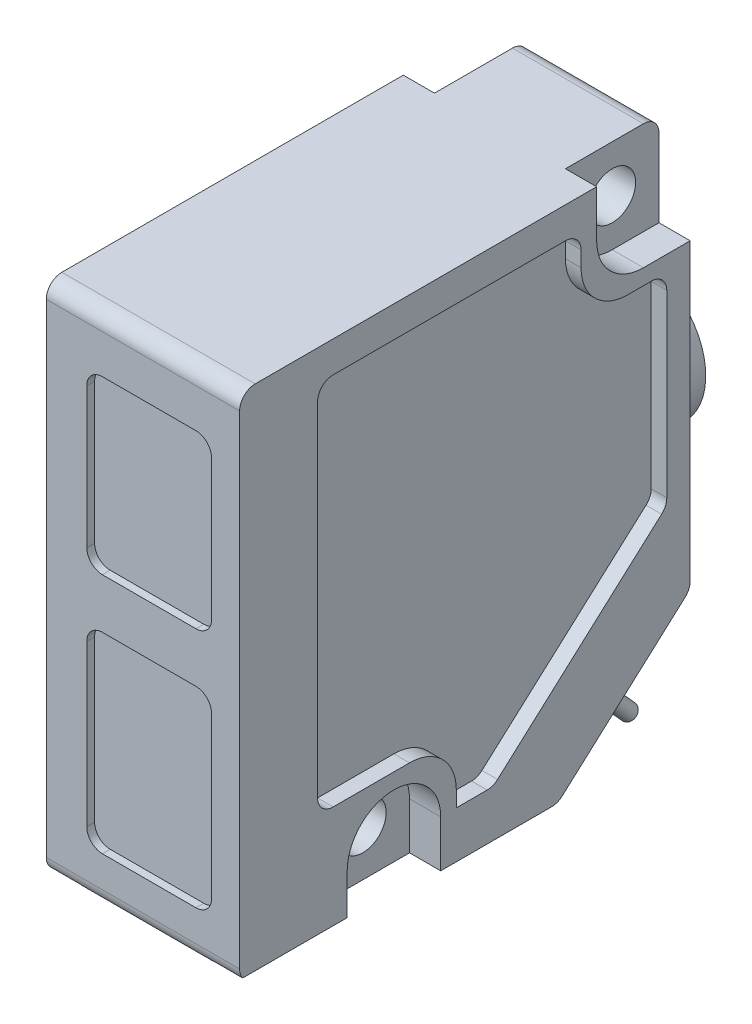
from build123d import *

# Parameters (mm, degrees)
BOSS_EXTRUDE1_DEPTH = 12.4
SKETCH2_R           = 1.5
CUT_EXTRUDE1_DEPTH  = 46.584756224
CUT_EXTRUDE2_DEPTH  = 2
CUT_EXTRUDE3_START  = -2
CUT_EXTRUDE3_DEPTH  = 2
CUT_EXTRUDE4_DEPTH  = 1
CUT_EXTRUDE5_START  = -1
CUT_EXTRUDE5_DEPTH  = 1
CUT_EXTRUDE6_DEPTH  = 0.5
SKETCH9_R           = 4.5
BOSS_EXTRUDE2_DEPTH = 0.5
SKETCH10_R          = 4.25
BOSS_EXTRUDE3_DEPTH = 0.5
SKETCH11_R          = 4.5
BOSS_EXTRUDE4_DEPTH = 1
SKETCH12_R          = 3
BOSS_EXTRUDE5_DEPTH = 1
SKETCH13_R          = 2
BOSS_EXTRUDE6_DEPTH = 3
BOSS_EXTRUDE7_DEPTH = 5


with BuildPart() as part:
    # Sketch1 → Boss-Extrude1 (new body)
    with BuildSketch(Plane(origin=(0, 0, 0), x_dir=(0, 0, -1), z_dir=(1, 0, 0))):
        with BuildLine():
            Line((1, 0), (27.9, 0))
            ThreePointArc((27.9, 0), (28.607106781, -0.292893219), (28.9, -1))
            Line((28.9, -1), (28.9, -24.904637595))
            ThreePointArc((28.9, -24.904637595), (28.813500063, -25.31147618), (28.568964732, -25.647931742))
            Line((28.568964732, -25.647931742), (20.685228726, -32.743294146))
            ThreePointArc((20.685228726, -32.743294146), (20.374527762, -32.933620412), (20.016263995, -33))
            Line((20.016263995, -33), (1, -33))
            ThreePointArc((1, -33), (0.292893219, -32.707106781), (0, -32))
            Line((0, -32), (0, -1))
            ThreePointArc((0, -1), (0.292893219, -0.292893219), (1, 0))
        make_face()
    extrude(amount=BOSS_EXTRUDE1_DEPTH)

    # Sketch2 → Cut-Extrude1 (cut, through all)
    with BuildSketch(Plane(origin=(12.4, 0, 0), x_dir=(0, 0, -1), z_dir=(1, 0, 0))):
        with Locations((25.9, -3)):
            Circle(SKETCH2_R)
        with Locations((9.9, -30)):
            Circle(SKETCH2_R)
    extrude(amount=-CUT_EXTRUDE1_DEPTH, mode=Mode.SUBTRACT)

    # Sketch3 → Cut-Extrude2 (cut)
    with BuildSketch(Plane(origin=(12.4, 0, 0), x_dir=(0, 0, -1), z_dir=(1, 0, 0))):
        with BuildLine():
            Line((6.9, -30), (6.9, -32.602246067))
            Line((6.9, -32.602246067), (0, -32.602246067))
            Line((0, -32.602246067), (0, -33))
            Line((0, -33), (6.9, -33))
            Line((6.9, -33), (12.9, -33))
            Line((12.9, -33), (12.9, -30))
            ThreePointArc((12.9, -30), (9.9, -27), (6.9, -30))
        make_face()
        with BuildLine():
            Line((22.9, 0), (28.9, 0))
            Line((28.9, 0), (28.9, -6))
            Line((28.9, -6), (25.9, -6))
            ThreePointArc((25.9, -6), (23.778679656, -5.121320344), (22.9, -3))
            Line((22.9, -3), (22.9, 0))
        make_face()
    extrude(amount=-CUT_EXTRUDE2_DEPTH, mode=Mode.SUBTRACT)

    # Sketch4 → Cut-Extrude3 (cut)
    with BuildSketch(Plane.ZY.offset(CUT_EXTRUDE3_START)):
        with BuildLine():
            Line((-12.9, -30), (-12.9, -33))
            Line((-12.9, -33), (-6.9, -33))
            Line((-6.9, -33), (0, -33))
            Line((0, -33), (0, -32.6))
            Line((0, -32.6), (-6.9, -32.6))
            Line((-6.9, -32.6), (-6.9, -30))
            ThreePointArc((-6.9, -30), (-9.9, -27), (-12.9, -30))
        make_face()
        with BuildLine():
            Line((-28.9, 0), (-22.9, 0))
            Line((-22.9, 0), (-22.9, -3))
            ThreePointArc((-22.9, -3), (-23.778679656, -5.121320344), (-25.9, -6))
            Line((-25.9, -6), (-28.9, -6))
            Line((-28.9, -6), (-28.9, 0))
        make_face()
    extrude(amount=CUT_EXTRUDE3_DEPTH, mode=Mode.SUBTRACT)

    # Sketch5 → Cut-Extrude4 (cut)
    with BuildSketch(Plane(origin=(12.4, 0, 0), x_dir=(0, 0, -1), z_dir=(1, 0, 0))):
        with BuildLine():
            Line((5, -3), (5, -25))
            ThreePointArc((5, -25), (5.292893219, -25.707106781), (6, -26))
            Line((6, -26), (10.9, -26))
            ThreePointArc((10.9, -26), (13.021320344, -26.878679656), (13.9, -29))
            Line((13.9, -29), (13.9, -30))
            Line((13.9, -30), (15.875361746, -30))
            ThreePointArc((15.875361746, -30), (16.233625514, -29.933620412), (16.544326478, -29.743294146))
            Line((16.544326478, -29.743294146), (27.068964732, -20.271119718))
            ThreePointArc((27.068964732, -20.271119718), (27.313500063, -19.934664157), (27.4, -19.527825572))
            Line((27.4, -19.527825572), (27.4, -8))
            ThreePointArc((27.4, -8), (27.107106781, -7.292893219), (26.4, -7))
            Line((26.4, -7), (24.9, -7))
            ThreePointArc((24.9, -7), (22.778679656, -6.121320344), (21.9, -4))
            Line((21.9, -4), (21.9, -3))
            ThreePointArc((21.9, -3), (21.607106781, -2.292893219), (20.9, -2))
            Line((20.9, -2), (6, -2))
            ThreePointArc((6, -2), (5.292893219, -2.292893219), (5, -3))
        make_face()
    extrude(amount=-CUT_EXTRUDE4_DEPTH, mode=Mode.SUBTRACT)

    # Sketch6 → Cut-Extrude5 (cut)
    with BuildSketch(Plane.ZY.offset(CUT_EXTRUDE5_START)):
        with BuildLine():
            Line((-6, -2), (-20.9, -2))
            ThreePointArc((-20.9, -2), (-21.607106781, -2.292893219), (-21.9, -3))
            Line((-21.9, -3), (-21.9, -4))
            ThreePointArc((-21.9, -4), (-22.778679656, -6.121320344), (-24.9, -7))
            Line((-24.9, -7), (-26.4, -7))
            ThreePointArc((-26.4, -7), (-27.107106781, -7.292893219), (-27.4, -8))
            Line((-27.4, -8), (-27.4, -19.527825572))
            ThreePointArc((-27.4, -19.527825572), (-27.313500063, -19.934664157), (-27.068964732, -20.271119718))
            Line((-27.068964732, -20.271119718), (-16.544326478, -29.743294146))
            ThreePointArc((-16.544326478, -29.743294146), (-16.233625514, -29.933620412), (-15.875361746, -30))
            Line((-15.875361746, -30), (-13.9, -30))
            Line((-13.9, -30), (-13.9, -29))
            ThreePointArc((-13.9, -29), (-13.021320344, -26.878679656), (-10.9, -26))
            Line((-10.9, -26), (-6, -26))
            ThreePointArc((-6, -26), (-5.292893219, -25.707106781), (-5, -25))
            Line((-5, -25), (-5, -3))
            ThreePointArc((-5, -3), (-5.292893219, -2.292893219), (-6, -2))
        make_face()
    extrude(amount=CUT_EXTRUDE5_DEPTH, mode=Mode.SUBTRACT)

    # Sketch8 → Cut-Extrude6 (cut)
    with BuildSketch(Plane.XY):
        with BuildLine():
            Line((3.6, -3.5), (9.6, -3.5))
            ThreePointArc((9.6, -3.5), (10.307106781, -3.792893219), (10.6, -4.5))
            Line((10.6, -4.5), (10.6, -13.5))
            ThreePointArc((10.6, -13.5), (10.307106781, -14.207106781), (9.6, -14.5))
            Line((9.6, -14.5), (3.6, -14.5))
            ThreePointArc((3.6, -14.5), (2.892893219, -14.207106781), (2.6, -13.5))
            Line((2.6, -13.5), (2.6, -4.5))
            ThreePointArc((2.6, -4.5), (2.892893219, -3.792893219), (3.6, -3.5))
        make_face()
        with BuildLine():
            Line((3.6, -17.7), (9.6, -17.7))
            ThreePointArc((9.6, -17.7), (10.307106781, -17.992893219), (10.6, -18.7))
            Line((10.6, -18.7), (10.6, -29))
            ThreePointArc((10.6, -29), (10.307106781, -29.707106781), (9.6, -30))
            Line((9.6, -30), (3.6, -30))
            ThreePointArc((3.6, -30), (2.892893219, -29.707106781), (2.6, -29))
            Line((2.6, -29), (2.6, -18.7))
            ThreePointArc((2.6, -18.7), (2.892893219, -17.992893219), (3.6, -17.7))
        make_face()
    extrude(amount=-CUT_EXTRUDE6_DEPTH, mode=Mode.SUBTRACT)

    # Sketch9 → Boss-Extrude2 (add)
    with BuildSketch(Plane(origin=(0, 0, -28.9), x_dir=(-1, 0, 0), z_dir=(0, 0, -1))):
        with Locations(Location((-6.9, -15, 0), (0, 0, 270))):
            Circle(SKETCH9_R)
    extrude(amount=BOSS_EXTRUDE2_DEPTH)

    # Sketch10 → Boss-Extrude3 (add)
    with BuildSketch(Plane(origin=(0, 0, -29.4), x_dir=(-1, 0, 0), z_dir=(0, 0, -1))):
        with Locations(Location((-6.9, -15, 0), (0, 0, 90))):
            Circle(SKETCH10_R)
    extrude(amount=BOSS_EXTRUDE3_DEPTH)

    # Sketch11 → Boss-Extrude4 (add)
    with BuildSketch(Plane(origin=(0, 0, -29.9), x_dir=(-1, 0, 0), z_dir=(0, 0, -1))):
        with Locations(Location((-6.9, -15, 0), (0, 0, 270))):
            Circle(SKETCH11_R)
    extrude(amount=BOSS_EXTRUDE4_DEPTH)

    # Sketch12 → Boss-Extrude5 (add)
    with BuildSketch(Plane(origin=(0, -28.375690608, -25.538121547), x_dir=(1, 0, 0), z_dir=(0, -0.7432941462471664, -0.6689647316224496))):
        with Locations(Location((6.2, 1.22565854, 0), (0, 0, 90))):
            Circle(SKETCH12_R)
    extrude(amount=BOSS_EXTRUDE5_DEPTH)

    # Sketch13 → Boss-Extrude6 (add)
    with BuildSketch(Plane(origin=(0, -29.118984754, -26.207086279), x_dir=(1, 0, 0), z_dir=(0, -0.7432941462471664, -0.6689647316224496))):
        with Locations(Location((6.2, 1.22565854, 0), (0, 0, 270))):
            Circle(SKETCH13_R)
    extrude(amount=BOSS_EXTRUDE6_DEPTH)

    # Sketch14 → Boss-Extrude7 (add)
    with BuildSketch(Plane(origin=(0, -31.348867193, -28.213980473), x_dir=(1, 0, 0), z_dir=(0, -0.7432941462471664, -0.6689647316224496))):
        with BuildLine():
            ThreePointArc((6.21, 1.126159796), (7.2, 1.22565854), (6.21, 1.325157284))
            ThreePointArc((6.21, 1.325157284), (5.22, 1.22565854), (6.21, 1.126159796))
        make_face()
    extrude(amount=BOSS_EXTRUDE7_DEPTH)


solid = part.part
